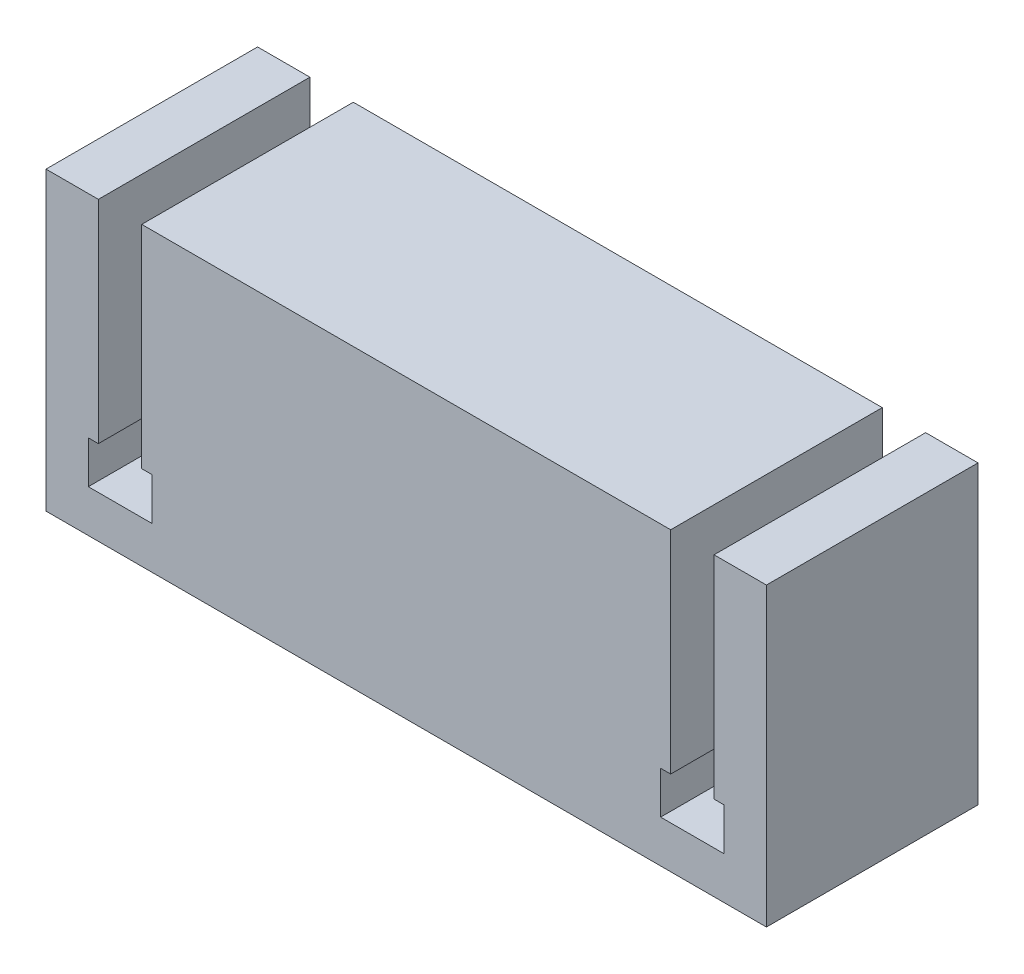
from build123d import *

# Parameters (mm, degrees)
BOSS_EXTRUDE1_DEPTH      = 25
BOSS_EXTRUDE1_DEPTH_BACK = 25


with BuildPart() as part:
    # Sketch1 → Boss-Extrude1 (new, two sides: drawn at the far end of the back side and taken through both)
    with BuildSketch(Plane.XY.offset(-BOSS_EXTRUDE1_DEPTH_BACK)):
        Polygon((85.125, -35), (-85.125, -35), (-85.125, 35), (-72.75, 35), (-72.75, -15), (-75.125, -15), (-75.125, -25), (-60.125, -25), (-60.125, -15), (-62.5, -15), (-62.5, 35), (62.5, 35), (62.5, -15), (60.125, -15), (60.125, -25), (75.125, -25), (75.125, -15), (72.75, -15), (72.75, 35), (85.125, 35), align=None)
    extrude(amount=BOSS_EXTRUDE1_DEPTH + BOSS_EXTRUDE1_DEPTH_BACK)


solid = part.part
